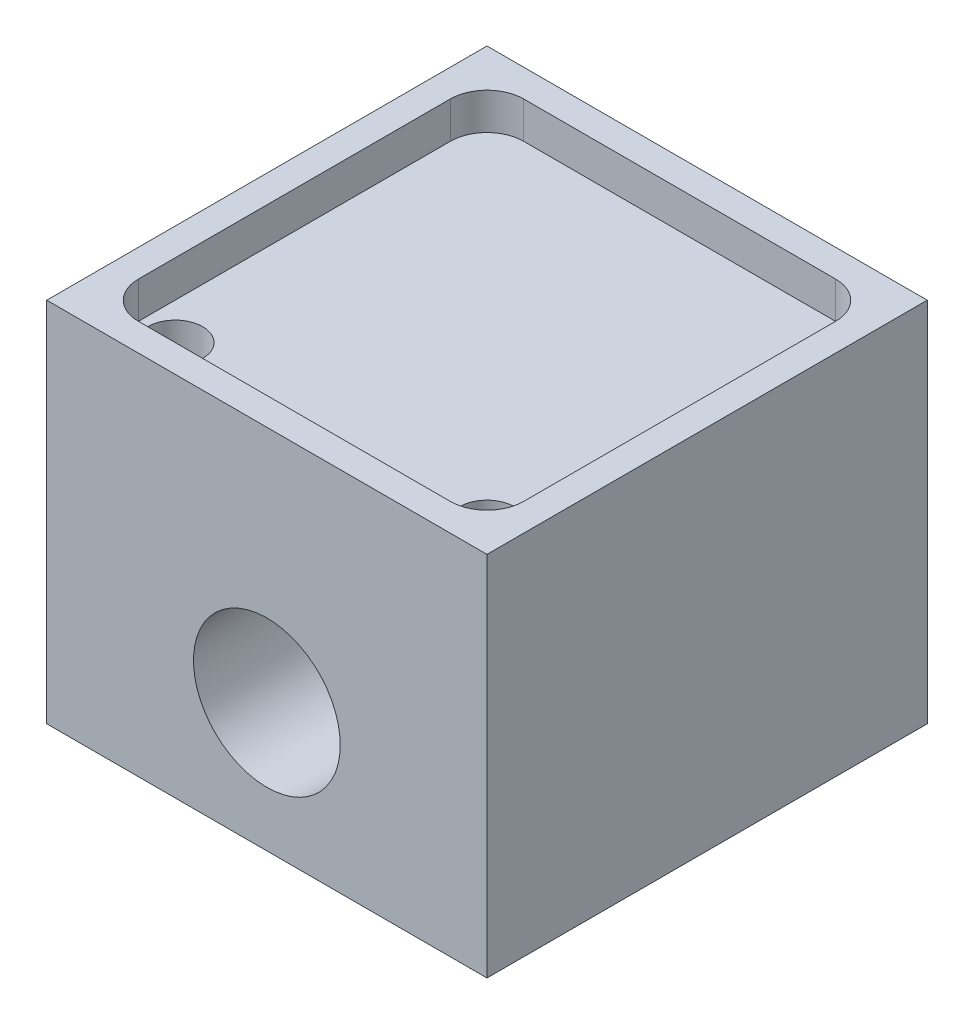
from build123d import *

# Parameters (mm, degrees)
SKETCH1_W           = 24
SKETCH1_H           = 24
BOSS_EXTRUDE1_DEPTH = 20
SKETCH2_W           = 21
SKETCH2_H           = 21
CUT_EXTRUDE1_DEPTH  = 2
FILLET2_R           = 2
SKETCH3_R           = 4
CUT_EXTRUDE2_DEPTH  = 42
SKETCH5_R           = 1.5
CUT_EXTRUDE3_DEPTH  = 42


with BuildPart() as part:
    # Sketch1 → Boss-Extrude1 (new body)
    with BuildSketch(Plane(origin=(0, 0, 0), x_dir=(1, 0, 0), z_dir=(0, 1, 0))):
        Rectangle(SKETCH1_W, SKETCH1_H)
    extrude(amount=BOSS_EXTRUDE1_DEPTH)

    # Sketch2 → Cut-Extrude1 (cut)
    with BuildSketch(Plane(origin=(0, 20, 0), x_dir=(1, 0, 0), z_dir=(0, 1, 0))):
        Rectangle(SKETCH2_W, SKETCH2_H)
    extrude(amount=-CUT_EXTRUDE1_DEPTH, mode=Mode.SUBTRACT)

    # Fillet2
    fillet2_edges = [part.edges().sort_by_distance(p)[0] for p in [
        (10.5, 19, -10.5),
        (10.5, 19, 10.5),
        (-10.5, 19, 10.5),
        (-10.5, 19, -10.5),
    ]]
    fillet(fillet2_edges, radius=FILLET2_R)

    # Sketch3 → Cut-Extrude2 (cut)
    with BuildSketch(Plane.XY.offset(12)):
        with Locations((0, 7)):
            Circle(SKETCH3_R)
    extrude(amount=-CUT_EXTRUDE2_DEPTH, mode=Mode.SUBTRACT)

    # Sketch5 → Cut-Extrude3 (cut)
    with BuildSketch(Plane(origin=(0, 18, 0), x_dir=(1, 0, 0), z_dir=(0, 1, 0))):
        with Locations(Location((-8.5, -8.5, 0), (0, 0, 270))):
            Circle(SKETCH5_R)
        with Locations(Location((8.5, -8.5, 0), (0, 0, 270))):
            Circle(SKETCH5_R)
    extrude(amount=-CUT_EXTRUDE3_DEPTH, mode=Mode.SUBTRACT)


solid = part.part
